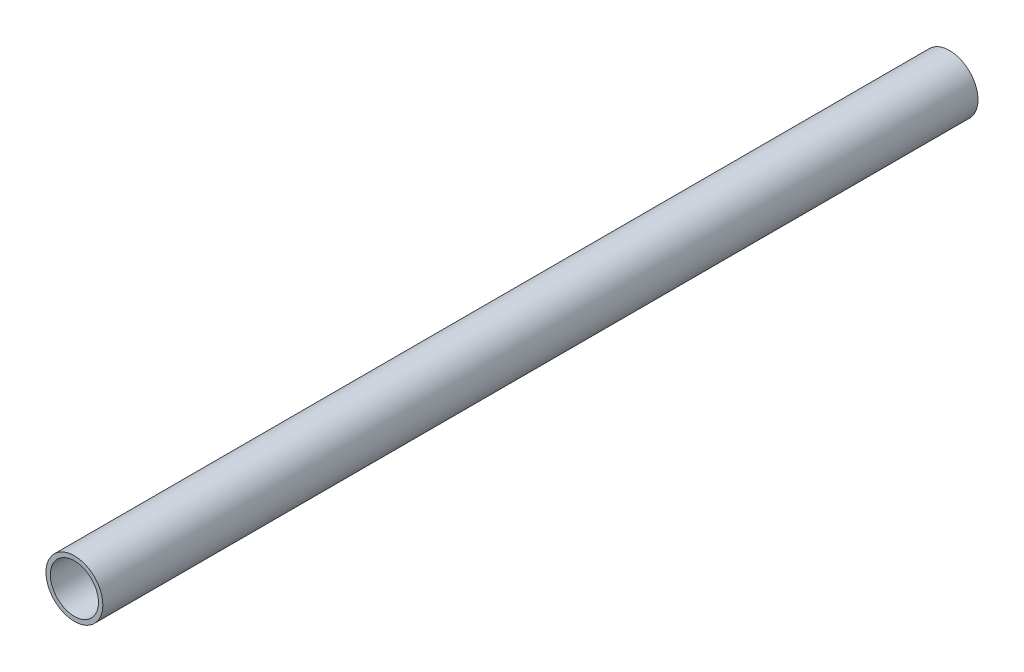
from build123d import *

# Parameters (mm, degrees)
SKETCH1_R           = 6.5
SKETCH1_R_2         = 5.5
BOSS_EXTRUDE1_DEPTH = 200


with BuildPart() as part:
    # Sketch1 → Boss-Extrude1 (new body)
    with BuildSketch(Plane.XY):
        Circle(SKETCH1_R)
        Circle(SKETCH1_R_2, mode=Mode.SUBTRACT)
    extrude(amount=BOSS_EXTRUDE1_DEPTH)


solid = part.part
